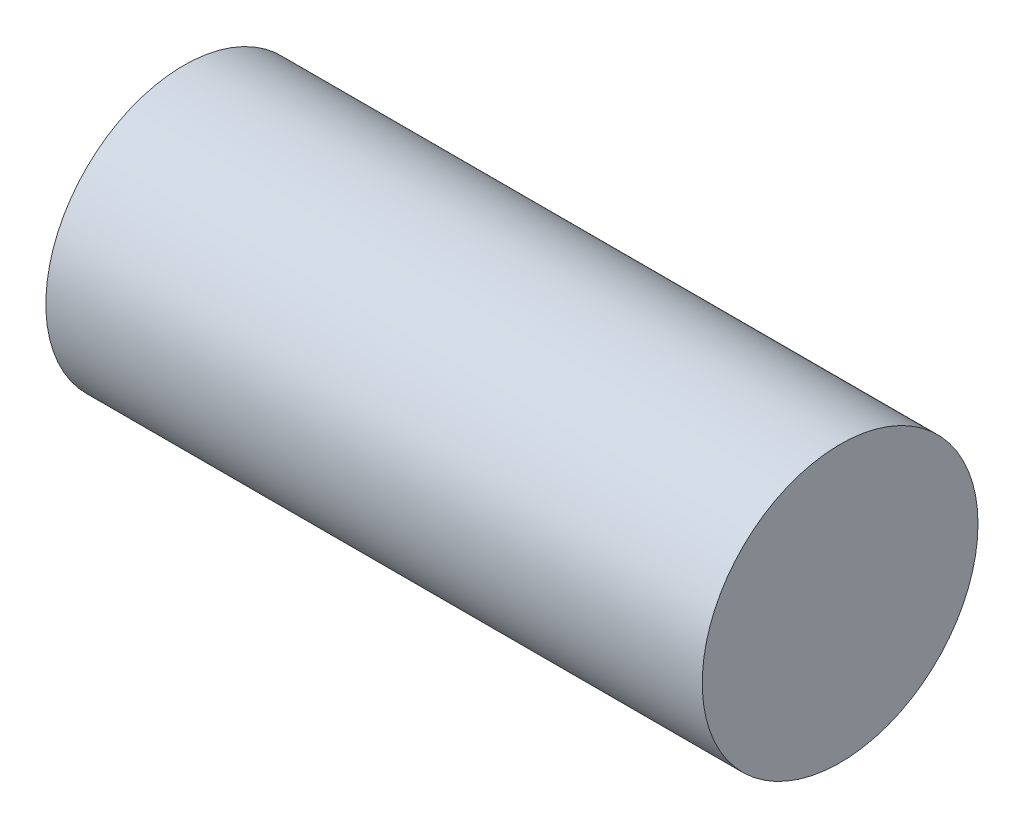
from build123d import *

# Parameters (mm, degrees)
SKETCH1_R           = 8.099936755
BOSS_EXTRUDE1_DEPTH = 38.558216


with BuildPart() as part:
    # Sketch1 → Boss-Extrude1 (new body)
    with BuildSketch(Plane(origin=(0, 0, 0), x_dir=(0, 0, -1), z_dir=(1, 0, 0))):
        with Locations((275.620988, 106.805984)):
            Circle(SKETCH1_R)
    extrude(amount=-BOSS_EXTRUDE1_DEPTH)


solid = part.part
